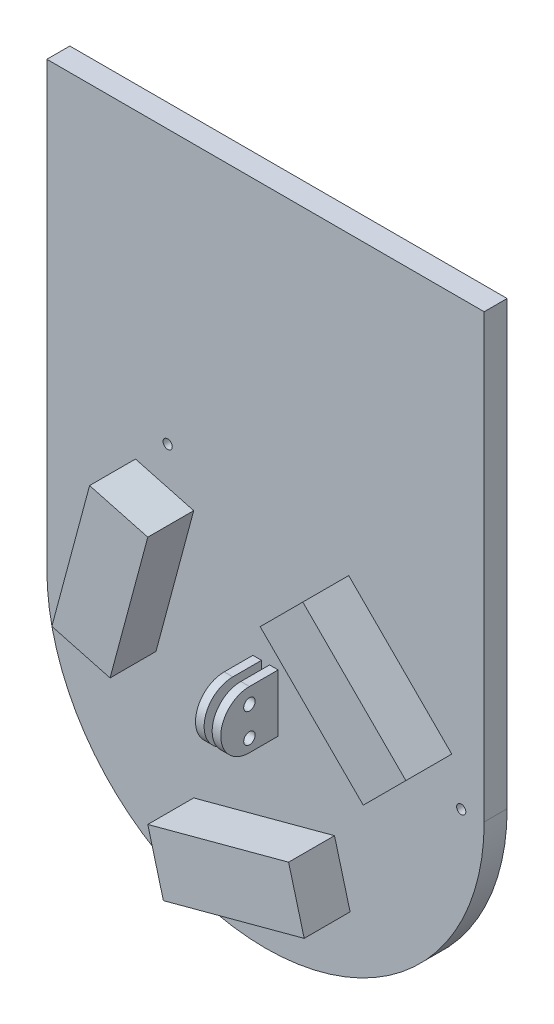
from build123d import *

# Parameters (mm, degrees)
SKETCH2_R           = 38.1
BOSS_EXTRUDE1_DEPTH = 4
SKETCH11_W          = 76.2
SKETCH11_H          = 77
BOSS_EXTRUDE4_DEPTH = 4
SKETCH3_R           = 0.8
CUT_EXTRUDE1_DEPTH  = 6
SKETCH4_R           = 0.6
CUT_EXTRUDE2_DEPTH  = 6
SKETCH5_W           = 1.5
SKETCH5_H           = 10
BOSS_EXTRUDE2_DEPTH = 10
CUT_EXTRUDE3_DEPTH  = 89.028915704
SKETCH7_R           = 1
CUT_EXTRUDE4_DEPTH  = 89.028915704
BOSS_EXTRUDE3_DEPTH = 8


with BuildPart() as part:
    # Sketch2 → Boss-Extrude1 (new body)
    with BuildSketch(Plane.XY):
        Circle(SKETCH2_R)
    extrude(amount=BOSS_EXTRUDE1_DEPTH)

    # Sketch11 → Boss-Extrude4 (add)
    with BuildSketch(Plane(origin=(0, 0, 0), x_dir=(-1, 0, 0), z_dir=(0, 0, -1))):
        with Locations((0, 38.5)):
            Rectangle(SKETCH11_W, SKETCH11_H)
    extrude(amount=-BOSS_EXTRUDE4_DEPTH)

    # Sketch3 → Cut-Extrude1 (cut)
    with BuildSketch(Plane.XY.offset(4)):
        with Locations((34.1, -0.085721815)):
            Circle(SKETCH3_R)
        with Locations((-17.05, -29.617188084)):
            Circle(SKETCH3_R)
        with Locations((-17.05, 29.445744454)):
            Circle(SKETCH3_R)
    extrude(amount=-CUT_EXTRUDE1_DEPTH, mode=Mode.SUBTRACT)

    # Sketch4 → Cut-Extrude2 (cut)
    with BuildSketch(Plane.XY.offset(4)):
        Circle(SKETCH4_R)
    extrude(amount=-CUT_EXTRUDE2_DEPTH, mode=Mode.SUBTRACT)

    # Sketch5 → Boss-Extrude2 (add)
    with BuildSketch(Plane.XY.offset(4)):
        with Locations((1.45, 0)):
            Rectangle(SKETCH5_W, SKETCH5_H)
        with Locations((-1.45, 0)):
            Rectangle(SKETCH5_W, SKETCH5_H)
    extrude(amount=BOSS_EXTRUDE2_DEPTH)

    # Sketch6 → Cut-Extrude3 (cut, through all)
    with BuildSketch(Plane(origin=(2.2, 0, 0), x_dir=(0, 0, -1), z_dir=(1, 0, 0))):
        with BuildLine():
            ThreePointArc((-14, 0), (-12.535533906, 3.535533906), (-9, 5))
            Line((-9, 5), (-14, 5))
            Line((-14, 5), (-14, 0))
        make_face()
        with BuildLine():
            ThreePointArc((-9, -5), (-12.535533906, -3.535533906), (-14, 0))
            Line((-14, 0), (-14, -5))
            Line((-14, -5), (-9, -5))
        make_face()
    extrude(amount=-CUT_EXTRUDE3_DEPTH, mode=Mode.SUBTRACT)

    # Sketch7 → Cut-Extrude4 (cut, through all)
    with BuildSketch(Plane(origin=(2.2, 0, 0), x_dir=(0, 0, -1), z_dir=(1, 0, 0))):
        with Locations(Location((-9, 2.3, 0), (0, 0, 90))):
            Circle(SKETCH7_R)
        with Locations(Location((-9, -2.8, 0), (0, 0, 90))):
            Circle(SKETCH7_R)
    extrude(amount=-CUT_EXTRUDE4_DEPTH, mode=Mode.SUBTRACT)

    # Sketch8 → Boss-Extrude3 (add)
    with BuildSketch(Plane.XY.offset(4)):
        Polygon((25.028792455, 0), (32.453413657, 7.424621202), (14.492901415, 25.385133445), (7.068280213, 17.960512242), align=None)
        Polygon((12.02011976, -15.101566346), (14.737719734, -25.243787522), (-9.796796254, -31.817791268), (-12.514396227, -21.675570092), align=None)
        Polygon((-19.088399973, -2.858945896), (-29.230621149, -0.141345922), (-22.656617403, 24.393170065), (-12.514396227, 21.675570092), align=None)
    extrude(amount=BOSS_EXTRUDE3_DEPTH)


solid = part.part
